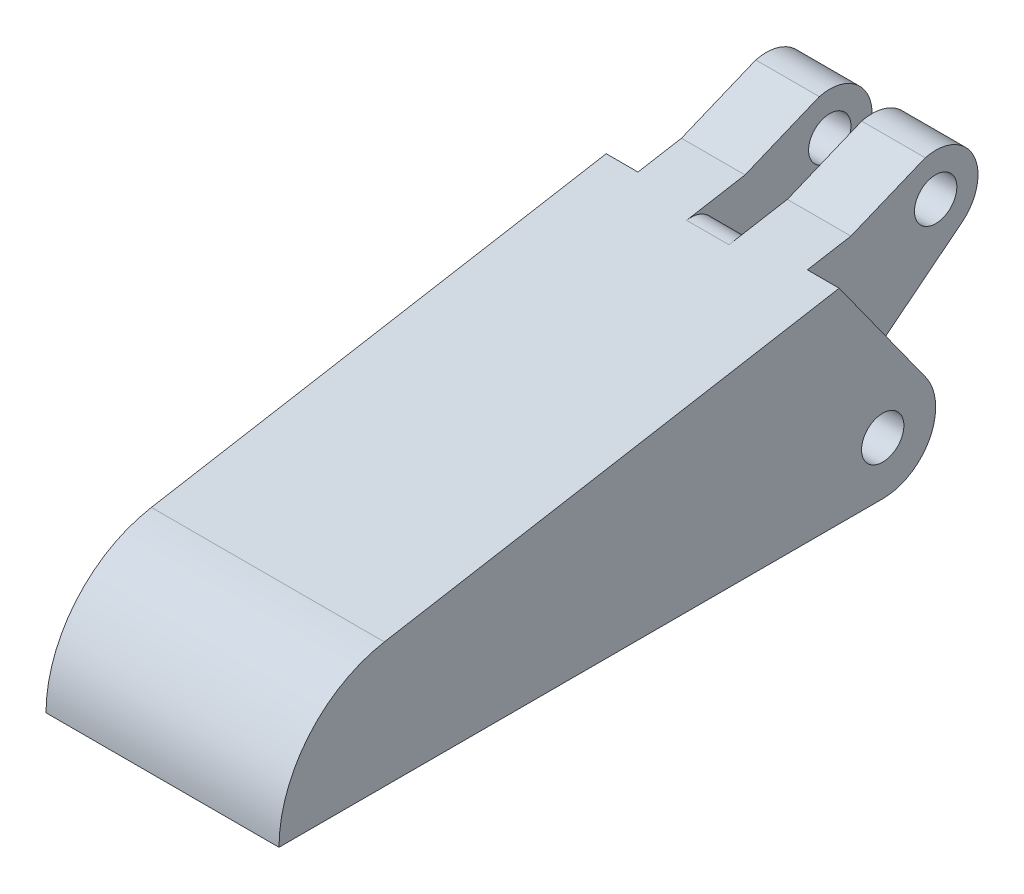
from build123d import *

# Parameters (mm, degrees)
SKETCH2_R                = 2
BOSS_EXTRUDE1_DEPTH      = 22
BOSS_EXTRUDE2_DEPTH      = 8
BOSS_EXTRUDE2_DEPTH_BACK = 8
SKETCH5_R                = 2
CUT_EXTRUDE1_DEPTH       = 2
CUT_EXTRUDE1_DEPTH_BACK  = 2


with BuildPart() as part:
    # Sketch2 → Boss-Extrude1 (new body)
    with BuildSketch(Plane.YZ):
        with BuildLine():
            Line((14.2713029, 4.10781366), (3.081429665, -3.937612376))
            Line((3.081429665, -3.937612376), (2.751400089, -4.174900903))
            ThreePointArc((2.751400089, -4.174900903), (-2.370970219, -4.402101796), (-5, 0))
            Line((-5, 0), (-5, 57))
            ThreePointArc((-5, 57), (2.726338919, 54.181703922), (6.823492726, 47.050614486))
            Line((6.823492726, 47.050614486), (14.2713029, 4.10781366))
        make_face()
        with Locations(Location((0, 0, 0), (0, 0, 270))):
            Circle(SKETCH2_R, mode=Mode.SUBTRACT)
    extrude(amount=BOSS_EXTRUDE1_DEPTH)

    # Sketch5 → Boss-Extrude2 (add, two sides: drawn at the far end of the back side and taken through both)
    with BuildSketch(Plane.YZ.offset(11).offset(-BOSS_EXTRUDE2_DEPTH_BACK)):
        with BuildLine():
            Line((14.2713029, 4.10781366), (14.983744003, 0))
            Line((14.983744003, 0), (17.876610129, -7.014153205))
            ThreePointArc((17.876610129, -7.014153205), (15.774722197, -11.584740035), (10.865645594, -10.48512021))
            Line((10.865645594, -10.48512021), (4.732907846, -2.750213262))
            Line((4.732907846, -2.750213262), (14.2713029, 4.10781366))
        make_face()
        with Locations(Location((14, -8, 0), (0, 0, 270))):
            Circle(SKETCH5_R, mode=Mode.SUBTRACT)
    extrude(amount=BOSS_EXTRUDE2_DEPTH + BOSS_EXTRUDE2_DEPTH_BACK)

    # Sketch6 → Cut-Extrude1 (cut, two sides: drawn at the far end of the back side and taken through both)
    with BuildSketch(Plane.YZ.offset(11).offset(-CUT_EXTRUDE1_DEPTH_BACK)):
        with BuildLine():
            Line((14.027483372, 5.513635398), (14.4433748, 3.11567649))
            Line((14.4433748, 3.11567649), (14.983744003, 0))
            Line((14.983744003, 0), (17.444478514, -5.966390458))
            ThreePointArc((17.444478514, -5.966390458), (16.264679643, -11.297154245), (10.865645594, -10.48512021))
            Line((10.865645594, -10.48512021), (4.41644607, -2.351076288))
            ThreePointArc((4.41644607, -2.351076288), (8.013457441, 1.376361406), (12.908459217, 3.070834826))
            ThreePointArc((12.908459217, 3.070834826), (13.846657415, 4.118762533), (14.027483372, 5.513635398))
        make_face()
    extrude(amount=CUT_EXTRUDE1_DEPTH + CUT_EXTRUDE1_DEPTH_BACK, mode=Mode.SUBTRACT)


solid = part.part
